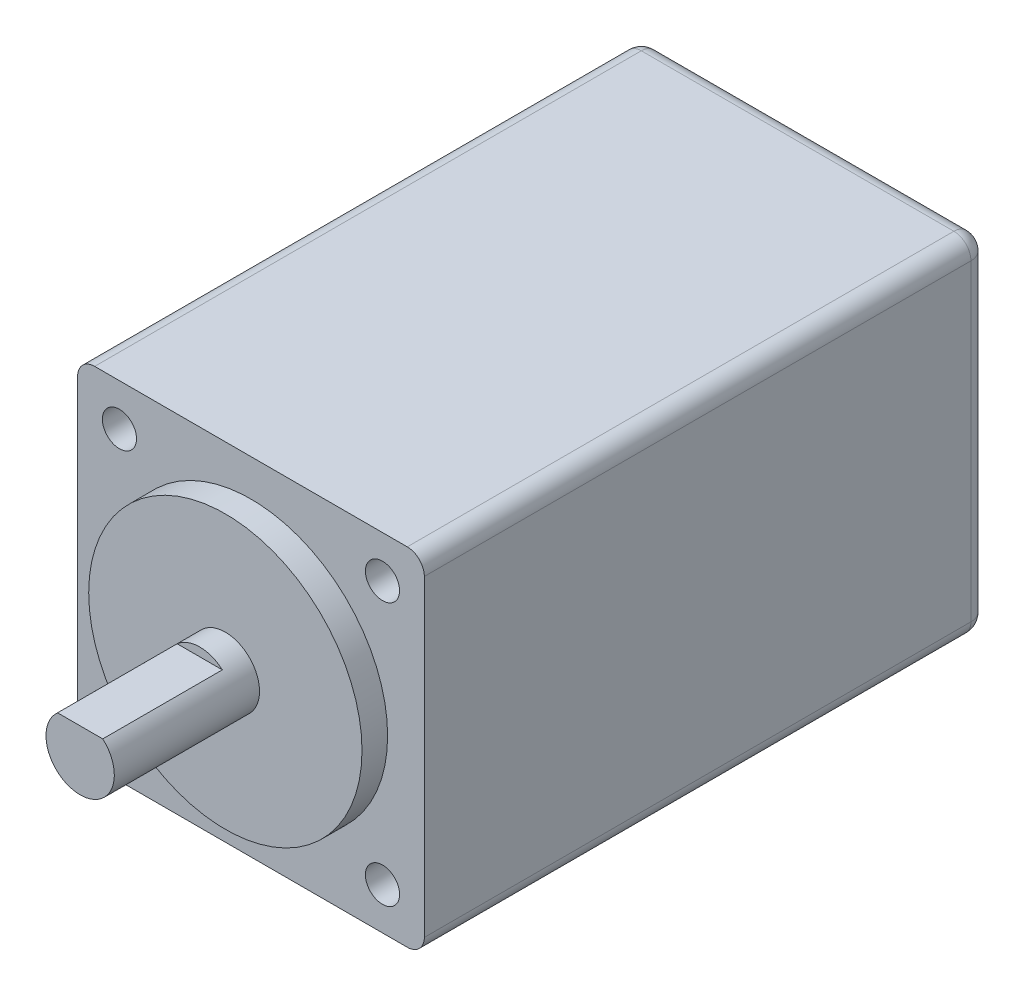
from build123d import *

# Parameters (mm, degrees)
SKETCH1_W           = 20.3
SKETCH1_H           = 20.3
BOSS_EXTRUDE1_DEPTH = 33
SKETCH2_R           = 8
BOSS_EXTRUDE2_DEPTH = 1.5
SKETCH3_R           = 2
BOSS_EXTRUDE3_DEPTH = 8.5
SKETCH4_W           = 7
SKETCH4_H           = 0.5
CUT_EXTRUDE1_DEPTH  = 5
SKETCH5_R           = 1
CUT_EXTRUDE2_DEPTH  = 2.5
FILLET1_R           = 1


with BuildPart() as part:
    # Sketch1 → Boss-Extrude1 (new body)
    with BuildSketch(Plane.XY):
        Rectangle(SKETCH1_W, SKETCH1_H)
    extrude(amount=BOSS_EXTRUDE1_DEPTH)

    # Sketch2 → Boss-Extrude2 (add)
    with BuildSketch(Plane.XY.offset(33)):
        with Locations(Location((0, 0, 0), (0, 0, 180))):
            Circle(SKETCH2_R)
    extrude(amount=BOSS_EXTRUDE2_DEPTH)

    # Sketch3 → Boss-Extrude3 (add)
    with BuildSketch(Plane.XY.offset(34.5)):
        Circle(SKETCH3_R)
    extrude(amount=BOSS_EXTRUDE3_DEPTH)

    # Sketch4 → Cut-Extrude1 (cut, symmetric)
    with BuildSketch(Plane(origin=(0, 0, 0), x_dir=(0, 0, -1), z_dir=(1, 0, 0))):
        with Locations((-39.5, 1.75)):
            Rectangle(SKETCH4_W, SKETCH4_H)
    extrude(amount=CUT_EXTRUDE1_DEPTH, both=True, mode=Mode.SUBTRACT)

    # Sketch5 → Cut-Extrude2 (cut)
    with BuildSketch(Plane.XY.offset(33)):
        with Locations((-7.7, 7.7)):
            Circle(SKETCH5_R)
        with Locations((7.7, 7.7)):
            Circle(SKETCH5_R)
        with Locations((7.7, -7.7)):
            Circle(SKETCH5_R)
        with Locations((-7.7, -7.7)):
            Circle(SKETCH5_R)
    extrude(amount=-CUT_EXTRUDE2_DEPTH, mode=Mode.SUBTRACT)

    # Fillet1
    fillet1_edges = [part.edges().sort_by_distance(p)[0] for p in [
        (0, -10.15, 0),
        (-10.15, 0, 0),
        (0, 10.15, 0),
        (10.15, 0, 0),
        (10.15, -10.15, 16.5),
        (-10.15, -10.15, 16.5),
        (-10.15, 10.15, 16.5),
        (10.15, 10.15, 16.5),
    ]]
    fillet(fillet1_edges, radius=FILLET1_R)


solid = part.part
